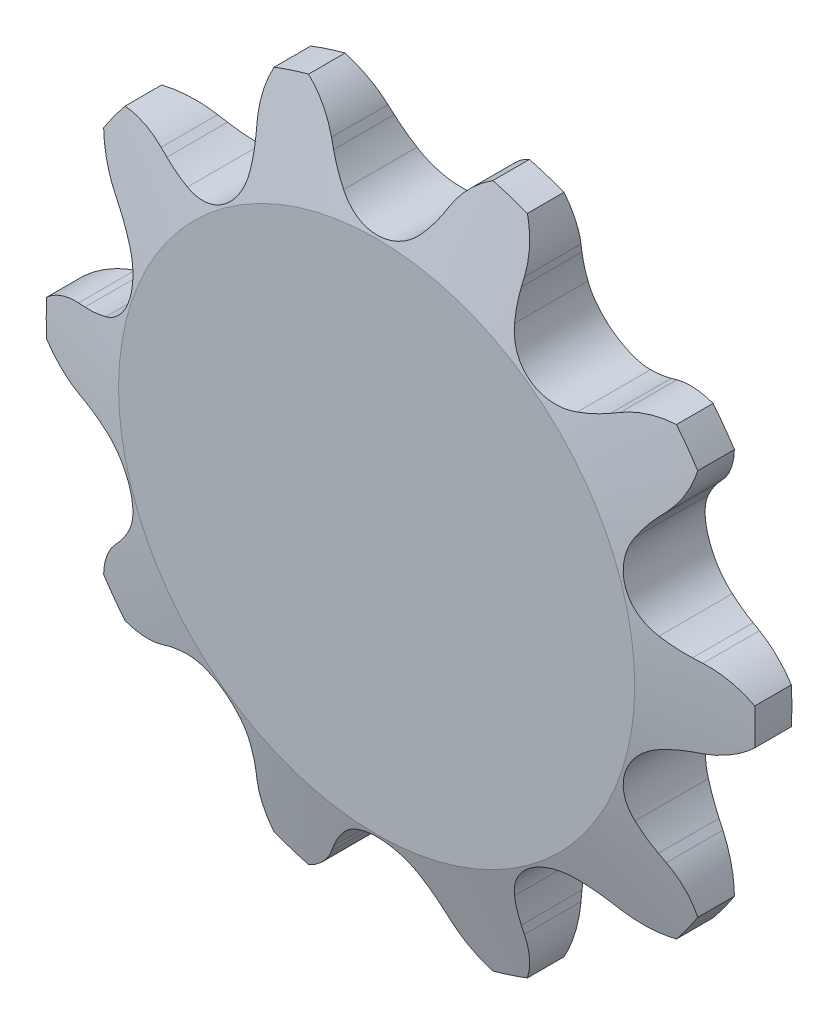
from build123d import *

# Parameters (mm, degrees)
CUT_EXTRUDE1_DEPTH = 17.572256837
CIRPATTERN3_COUNT  = 10


with BuildPart() as part:
    # Sketch7 → Revolve1 (revolve)
    with BuildSketch(Plane(origin=(0, 0, 0), x_dir=(0, 0, -1), z_dir=(1, 0, 0)), mode=Mode.PRIVATE) as revolve1_sk:
        Polygon((-1.397, 0), (1.397, 0), (1.397, 8.501645231), (0.60325, 11.676645231), (-0.60325, 11.676645231), (-1.397, 8.501645231), align=None)
    revolve(revolve1_sk.sketch.rotate(Axis((0, 0, -87.4025), (0, 0, 1)), 90), axis=Axis((0, 0, -87.4025), (0, 0, 1)))

    # Tooth Profile → Cut-Extrude1 (cut, symmetric)
    with BuildSketch(Plane.XY):
        with BuildLine():
            Line((-1.815887794, 9.930538929), (-1.951417648, 10.179118266))
            ThreePointArc((-1.951417648, 10.179118266), (-2.706520122, 11.059515893), (-3.754762546, 11.555970874))
            ThreePointArc((-3.754762546, 11.555970874), (0, 12.150666838), (3.754762546, 11.555970874))
            ThreePointArc((3.754762546, 11.555970874), (2.706520122, 11.059515893), (1.951417648, 10.179118266))
            Line((1.951417648, 10.179118266), (1.815887794, 9.930538929))
            ThreePointArc((1.815887794, 9.930538929), (1.566335908, 9.533558278), (1.275402965, 9.165824946))
            ThreePointArc((1.275402965, 9.165824946), (0, 8.584590329), (-1.275402965, 9.165824946))
            ThreePointArc((-1.275402965, 9.165824946), (-1.566335908, 9.533558278), (-1.815887794, 9.930538929))
        make_face()
    cut_extrude1 = extrude(amount=CUT_EXTRUDE1_DEPTH, both=True, mode=Mode.SUBTRACT)

    # CirPattern3: Cut-Extrude1 ×10 about axis
    cirpattern3_axis = Axis((0, 0, 0), (0, 0, 1))
    for i in range(1, CIRPATTERN3_COUNT):
        add(cut_extrude1.rotate(cirpattern3_axis, i * 360 / CIRPATTERN3_COUNT), mode=Mode.SUBTRACT)


solid = part.part
